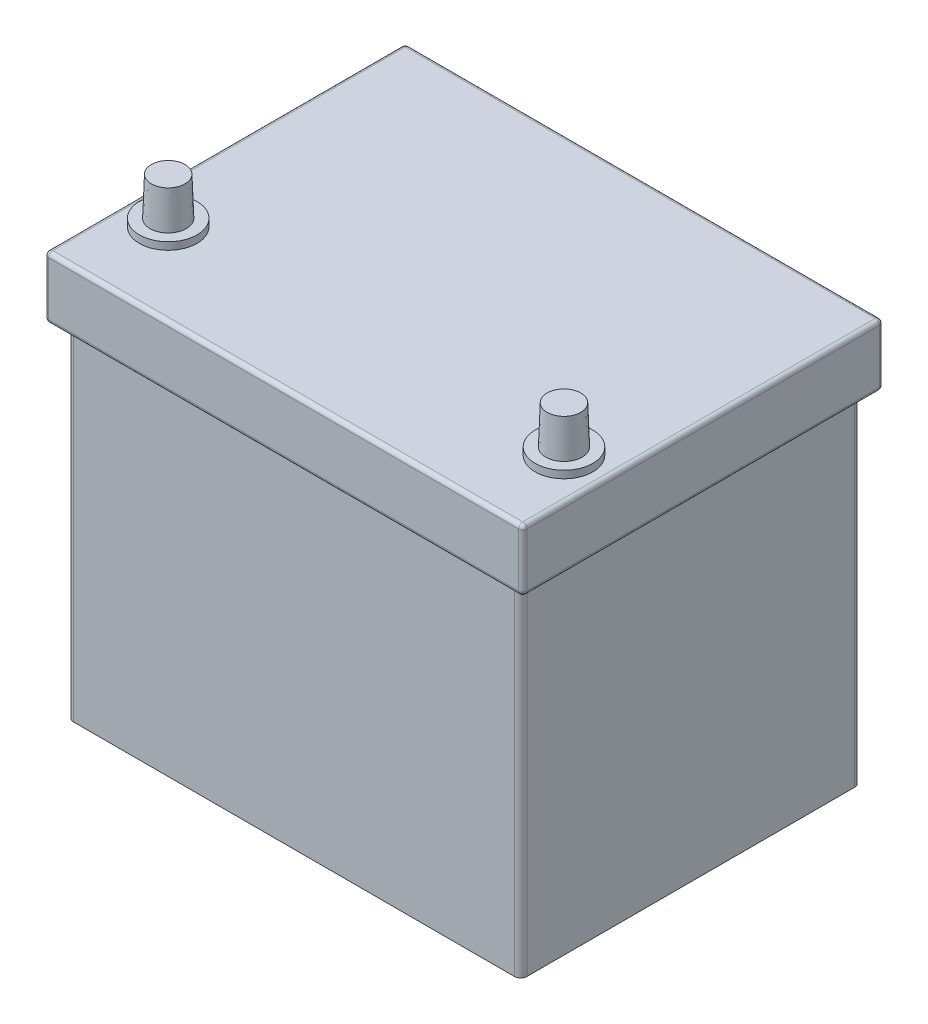
from build123d import *

# Parameters (mm, degrees)
SKETCH_1_W                = 220
SKETCH_1_H                = 165
EXTRUDE_1_DEPTH           = 166
FILLET_1_R                = 3
SKETCH_2_W                = 232
SKETCH_2_H                = 175
EXTRUDE_2_DEPTH           = 30
FILLET_2_R                = 2
SKETCH_3_R                = 14
EXTRUDE_3_DEPTH           = 3.6
SKETCH_5_R                = 8.8
EXTRUDE_4_DEPTH           = 18.5
EXTRUDE_4_DRAFT           = 2
EXTRUDE_4_PROFILE_2_DEPTH = 18.5
EXTRUDE_4_PROFILE_2_DRAFT = 2


with BuildPart() as part:
    # Эскиз1 → Вытянуть1 (new body)
    with BuildSketch(Plane(origin=(0, 0, 0), x_dir=(1, 0, 0), z_dir=(0, 1, 0))):
        Rectangle(SKETCH_1_W, SKETCH_1_H)
    extrude(amount=EXTRUDE_1_DEPTH)

    # Скругление1
    fillet_1_edges = [part.edges().sort_by_distance(p)[0] for p in [
        (110, 83, 82.5),
        (-110, 83, 82.5),
        (-110, 83, -82.5),
        (110, 83, -82.5),
    ]]
    fillet(fillet_1_edges, radius=FILLET_1_R)

    # Эскиз2 → Вытянуть2 (add)
    with BuildSketch(Plane(origin=(0, 166, 0), x_dir=(1, 0, 0), z_dir=(0, 1, 0))):
        Rectangle(SKETCH_2_W, SKETCH_2_H)
    extrude(amount=EXTRUDE_2_DEPTH)

    # Скругление2
    fillet_2_edges = [part.edges().sort_by_distance(p)[0] for p in [
        (116, 166, 0),
        (116, 181, 87.5),
        (0, 166, -87.5),
        (116, 181, -87.5),
        (-116, 166, 0),
        (-116, 181, -87.5),
        (0, 166, 87.5),
        (-116, 181, 87.5),
        (116, 196, 0),
        (0, 196, -87.5),
        (-116, 196, 0),
        (0, 196, 87.5),
    ]]
    fillet(fillet_2_edges, radius=FILLET_2_R)

    # Эскиз3 → Вытянуть3 (add)
    with BuildSketch(Plane(origin=(0, 196, 0), x_dir=(1, 0, 0), z_dir=(0, 1, 0))):
        with Locations(Location((96, -47.5, 0), (0, 0, 270))):
            Circle(SKETCH_3_R)
        with Locations(Location((-96, -47.5, 0), (0, 0, 90))):
            Circle(SKETCH_3_R)
    extrude(amount=EXTRUDE_3_DEPTH)


with BuildPart() as extrude_4_tool:
    # Эскиз5 → Вытянуть4 (with draft: the straight prism first)
    with BuildSketch(Plane(origin=(0, 199.6, 0), x_dir=(1, 0, 0), z_dir=(0, 1, 0))):
        with Locations((96, -47.5)):
            Circle(SKETCH_5_R)
    extrude(amount=EXTRUDE_4_DEPTH)
    # Вытянуть4: the draft: its side faces are tilted about the plane it starts from
    extrude_4_sides = [extrude_4_tool.faces().sort_by_distance(p)[0] for p in [
        (87.2, 208.85, 47.5),
    ]]
    draft(extrude_4_sides, Plane(origin=(0, 199.6, 0), x_dir=(1, 0, 0), z_dir=(0, 1, 0)), EXTRUDE_4_DRAFT)


with BuildPart() as part_1:
    add(part.part)

    # Вытянуть4: add extrude_4_tool
    add(extrude_4_tool.part)


with BuildPart() as extrude_4_profile_2_tool:
    # Эскиз5 → Вытянуть4 profile 2 (with draft: the straight prism first)
    with BuildSketch(Plane(origin=(0, 199.6, 0), x_dir=(1, 0, 0), z_dir=(0, 1, 0))):
        with Locations((-96, -47.5)):
            Circle(SKETCH_5_R)
    extrude(amount=EXTRUDE_4_PROFILE_2_DEPTH)
    # Вытянуть4 profile 2: the draft: its side faces are tilted about the plane it starts from
    extrude_4_profile_2_sides = [extrude_4_profile_2_tool.faces().sort_by_distance(p)[0] for p in [
        (-104.8, 208.85, 47.5),
    ]]
    draft(extrude_4_profile_2_sides, Plane(origin=(0, 199.6, 0), x_dir=(1, 0, 0), z_dir=(0, 1, 0)), EXTRUDE_4_PROFILE_2_DRAFT)


with BuildPart() as part_2:
    add(part_1.part)

    # Вытянуть4 profile 2: add extrude_4_profile_2_tool
    add(extrude_4_profile_2_tool.part)


solid = part_2.part
